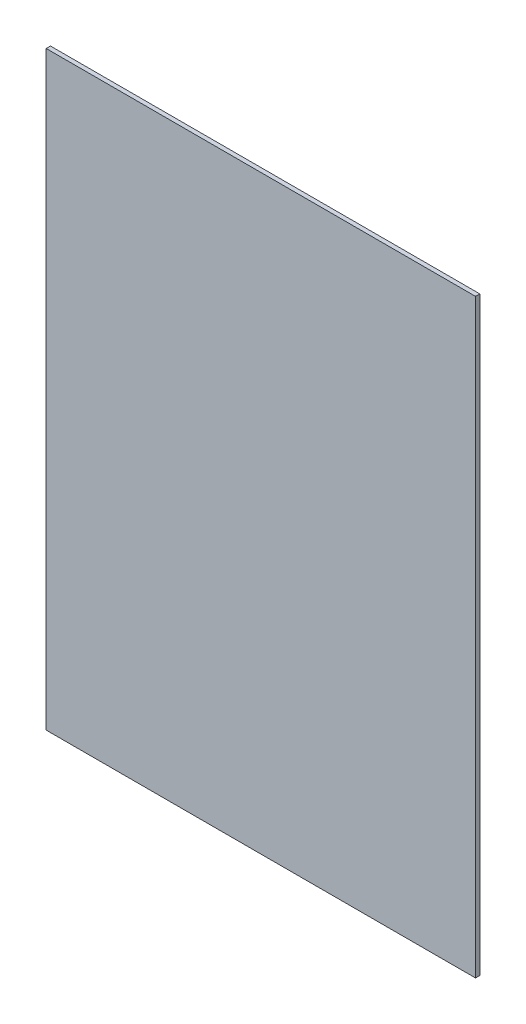
from build123d import *

# Parameters (mm, degrees)
ESQUISSE1_W        = 400
ESQUISSE1_H        = 550
BOSS_EXTRU_1_DEPTH = 4


with BuildPart() as part:
    # Esquisse1 → Boss.-Extru.1 (new body)
    with BuildSketch(Plane.XY):
        Rectangle(ESQUISSE1_W, ESQUISSE1_H)
    extrude(amount=BOSS_EXTRU_1_DEPTH)


solid = part.part
